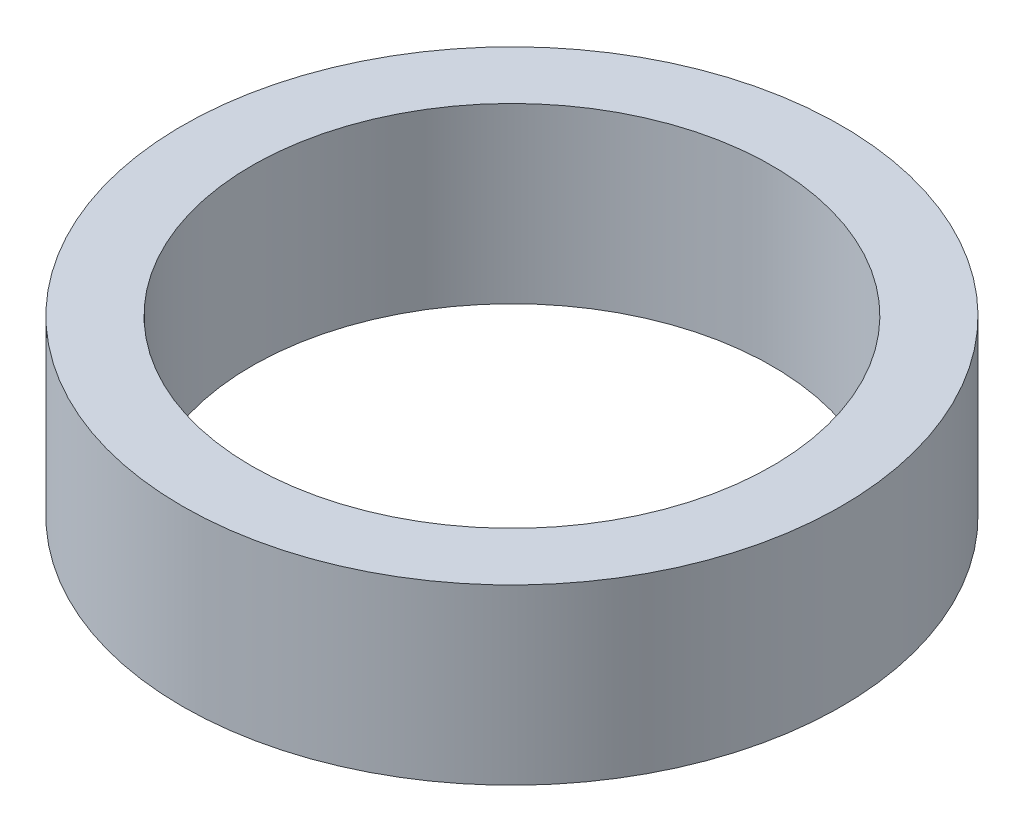
from build123d import *

# Parameters (mm, degrees)
SKETCH1_R           = 19
SKETCH1_R_2         = 15
BOSS_EXTRUDE1_DEPTH = 10


with BuildPart() as part:
    # Sketch1 → Boss-Extrude1 (new body)
    with BuildSketch(Plane(origin=(0, 0, 0), x_dir=(1, 0, 0), z_dir=(0, 1, 0))):
        with Locations(Location((0, 0, 0), (0, 0, 270))):
            Circle(SKETCH1_R)
        with Locations(Location((0, 0, 0), (0, 0, 270))):
            Circle(SKETCH1_R_2, mode=Mode.SUBTRACT)
    extrude(amount=BOSS_EXTRUDE1_DEPTH)


solid = part.part
